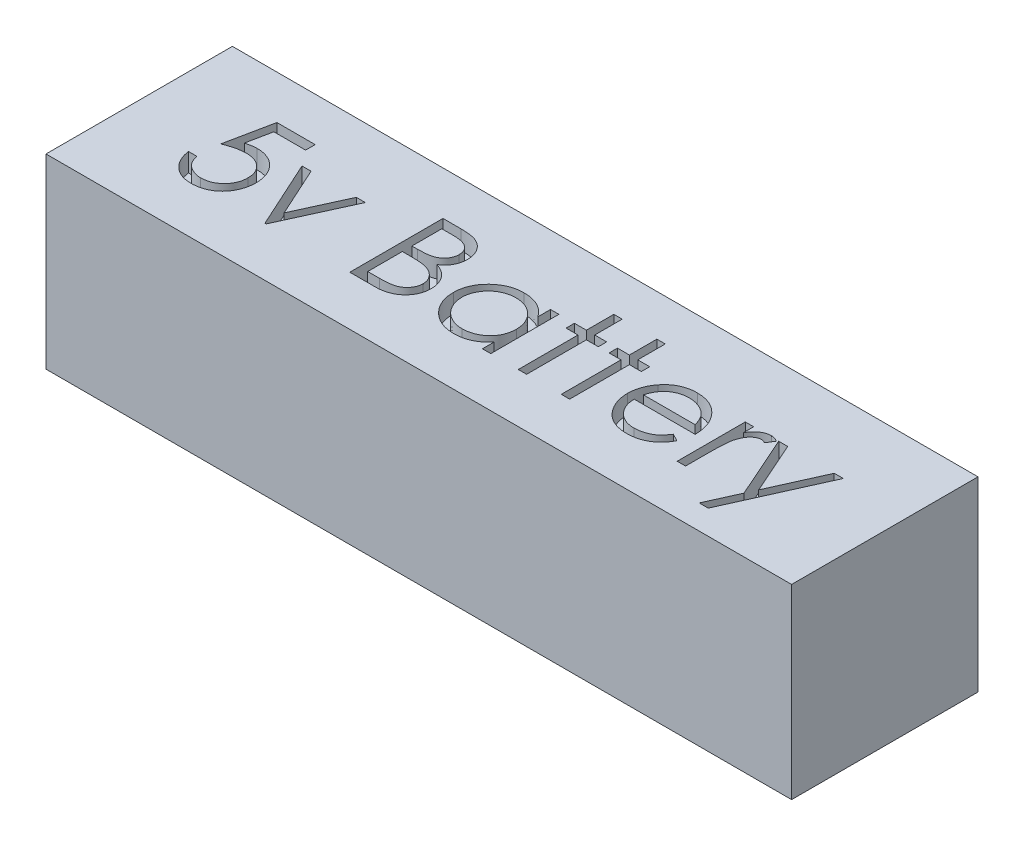
from build123d import *

# Parameters (mm, degrees)
SKETCH1_W           = 101.6
SKETCH1_H           = 25.4
BOSS_EXTRUDE1_DEPTH = 25.4
CUT_EXTRUDE1_DEPTH  = 2.54


with BuildPart() as part:
    # Sketch1 → Boss-Extrude1 (new body)
    with BuildSketch(Plane(origin=(0, 0, 0), x_dir=(1, 0, 0), z_dir=(0, 1, 0))):
        Rectangle(SKETCH1_W, SKETCH1_H)
    extrude(amount=BOSS_EXTRUDE1_DEPTH)

    # Sketch2 → Cut-Extrude1 (cut)
    # profile 1 of 9: a face of its own
    with BuildSketch(Plane(origin=(0, 25.4, 0), x_dir=(1, 0, 0), z_dir=(0, 1, 0))):
        with BuildLine():
            Line((-33.566758385, 6.741806463), (-33.566758385, 5.439242361))
            Line((-33.566758385, 5.439242361), (-37.886590115, 5.439242361))
            Line((-37.886590115, 5.439242361), (-38.570945083, 2.098877777))
            add(Edge.make_bspline(
                [(-38.570945083, 2.098877777), (-38.436485196, 2.135999049), (-38.175990431, 2.207915643), (-37.791507507, 2.287765152), (-37.426501512, 2.335899764), (-37.189645168, 2.342472233), (-37.075031622, 2.345652617)],
                knots=[0, 0, 0, 0, 1.100273476, 2.13160584, 3.095893838, 4, 4, 4, 4], degree=3))
            add(Edge.make_bspline(
                [(-37.075031622, 2.345652617), (-36.933213481, 2.342583079), (-36.654363582, 2.3365476), (-36.246370831, 2.278592604), (-35.856905761, 2.187370628), (-35.486782875, 2.059933306), (-35.135317449, 1.896975131), (-34.805743154, 1.69341249), (-34.493113013, 1.455620117), (-34.203035601, 1.18222536), (-33.939875968, 0.88133835), (-33.70849652, 0.557822647), (-33.511963692, 0.214822273), (-33.353900382, -0.150939936), (-33.22768294, -0.535420293), (-33.143674273, -0.942664235), (-33.087733643, -1.368833128), (-33.081483842, -1.660223996), (-33.078296846, -1.80881453)],
                knots=[0, 0, 0, 0, 1.052922333, 2.070308379, 3.05430497, 4.020497103, 4.973039431, 5.925935799, 6.892292201, 7.88610001, 8.88166317, 9.857072816, 10.836096531, 11.812156883, 12.81219415, 13.836441305, 14.89672472, 16, 16, 16, 16], degree=3))
            add(Edge.make_bspline(
                [(-33.078296846, -1.80881453), (-33.080710119, -1.912309444), (-33.085504052, -2.117900628), (-33.109882927, -2.42322387), (-33.156821097, -2.722083293), (-33.219841125, -3.014518544), (-33.301637898, -3.29997598), (-33.40065818, -3.579272667), (-33.521838051, -3.85067024), (-33.654757613, -4.116736673), (-33.804423404, -4.371456971), (-33.970533988, -4.609669008), (-34.146031628, -4.834946258), (-34.334867512, -5.04487266), (-34.538796837, -5.238068754), (-34.75534986, -5.415681089), (-34.982798583, -5.580713345), (-35.224661891, -5.726466511), (-35.475550329, -5.860589237), (-35.739087003, -5.970620358), (-36.009272973, -6.068992846), (-36.28999695, -6.14740456), (-36.58062307, -6.208845544), (-36.881630398, -6.250576295), (-37.191440258, -6.280970796), (-37.401443875, -6.282873463), (-37.507523609, -6.283834563)],
                knots=[0, 0, 0, 0, 1.056347294, 2.098418968, 3.122841568, 4.141288669, 5.149314143, 6.15115421, 7.162517403, 8.180376062, 9.185164535, 10.17417709, 11.141909838, 12.097768115, 13.052685741, 14.0056014, 14.954263652, 15.917497458, 16.885230207, 17.854509472, 18.828990115, 19.81800267, 20.826176721, 21.857883937, 22.917946725, 24, 24, 24, 24], degree=3))
            add(Edge.make_bspline(
                [(-37.507523609, -6.283834563), (-37.634067065, -6.281327808), (-37.883026365, -6.276396063), (-38.247772422, -6.224803274), (-38.598708277, -6.150911349), (-38.93300893, -6.039745455), (-39.253670373, -5.900454415), (-39.556375663, -5.724410021), (-39.848859479, -5.524914416), (-40.119231726, -5.289491421), (-40.370169624, -5.032168803), (-40.594801813, -4.752922505), (-40.794857935, -4.456361387), (-40.967134331, -4.141045228), (-41.114084294, -3.807802558), (-41.229527251, -3.455384812), (-41.322702996, -3.085633369), (-41.362121693, -2.831076346), (-41.382143, -2.70178328)],
                knots=[0, 0, 0, 0, 1.0467383, 2.05933395, 3.04377827, 4.011590433, 4.970194871, 5.932262533, 6.905835911, 7.896367577, 8.894135286, 9.877477877, 10.858688626, 11.851381753, 12.8477658, 13.868841284, 14.917554742, 16, 16, 16, 16], degree=3))
            Line((-41.382143, -2.70178328), (-40.24239941, -2.70178328))
            add(Edge.make_bspline(
                [(-40.24239941, -2.70178328), (-40.214355788, -2.822892122), (-40.160454388, -3.055670041), (-40.0421421, -3.382718051), (-39.897485923, -3.674162091), (-39.725475859, -3.933857436), (-39.520280034, -4.16031294), (-39.286130392, -4.362123422), (-39.02361151, -4.544187463), (-38.731898935, -4.695944361), (-38.424148618, -4.825370981), (-38.102050456, -4.911555702), (-37.774374685, -4.972156085), (-37.552747456, -4.978222188), (-37.441377776, -4.98127046)],
                knots=[0, 0, 0, 0, 1.136247022, 2.183929868, 3.172523383, 4.106158343, 5.02341133, 5.958108904, 6.928429099, 7.938127109, 8.96079061, 9.975095812, 10.982467395, 12, 12, 12, 12], degree=3))
            add(Edge.make_bspline(
                [(-37.441377776, -4.98127046), (-37.33267142, -4.978292209), (-37.118627717, -4.972428008), (-36.803626399, -4.927292164), (-36.499505399, -4.857777548), (-36.209265561, -4.753746931), (-35.927827975, -4.627310381), (-35.662311722, -4.465058535), (-35.405035568, -4.278332182), (-35.163996341, -4.064403839), (-34.943236053, -3.828656661), (-34.748178128, -3.576552977), (-34.585701899, -3.307614705), (-34.44878099, -3.026497836), (-34.344810449, -2.730121357), (-34.270638888, -2.419874236), (-34.227084932, -2.094990165), (-34.221093507, -1.873395812), (-34.218040436, -1.760477191)],
                knots=[0, 0, 0, 0, 1.027316725, 2.022795036, 3.002884548, 3.971462791, 4.93288096, 5.914575861, 6.907176829, 7.935150275, 8.956128384, 9.956726525, 10.942570165, 11.921478529, 12.907843606, 13.90538589, 14.932640048, 16, 16, 16, 16], degree=3))
            add(Edge.make_bspline(
                [(-34.218040436, -1.760477191), (-34.220429776, -1.658602321), (-34.225106568, -1.459196757), (-34.263317495, -1.167462494), (-34.329781937, -0.891426026), (-34.422034302, -0.629754377), (-34.539162801, -0.382200744), (-34.682296563, -0.148509639), (-34.85412175, 0.068238841), (-35.050398031, 0.268146107), (-35.265420066, 0.452640367), (-35.50288736, 0.609917481), (-35.757830523, 0.742229411), (-36.027177927, 0.85641329), (-36.317336273, 0.938421709), (-36.622559482, 0.999990894), (-36.946143537, 1.035606638), (-37.167380034, 1.040548348), (-37.281101333, 1.043088514)],
                knots=[0, 0, 0, 0, 1.045622112, 2.046656509, 3.013763289, 3.955457236, 4.890082067, 5.820317437, 6.762574623, 7.722996705, 8.69280354, 9.665887285, 10.63943826, 11.638615906, 12.663482002, 13.728887084, 14.832589034, 16, 16, 16, 16], degree=3))
            add(Edge.make_bspline(
                [(-37.281101333, 1.043088514), (-37.379540589, 1.040981798), (-37.582792679, 1.036631963), (-37.894569793, 1.004604389), (-38.222199759, 0.952936092), (-38.564426643, 0.881865994), (-38.922278201, 0.788861801), (-39.294999255, 0.677412042), (-39.683373479, 0.544163646), (-39.945057794, 0.443535328), (-40.079578897, 0.391806463)],
                knots=[0, 0, 0, 0, 0.817624296, 1.688186739, 2.600797293, 3.572016777, 4.590301741, 5.671205678, 6.80286297, 8, 8, 8, 8], degree=3))
            Line((-40.079578897, 0.391806463), (-38.777014795, 6.741806463))
            Line((-38.777014795, 6.741806463), (-33.566758385, 6.741806463))
        make_face()
    # profile 2 of 9: a face of its own
    with BuildSketch(Plane(origin=(0, 25.4, 0), x_dir=(1, 0, 0), z_dir=(0, 1, 0))):
        Polygon((-31.938553256, 3.322575694), (-30.704679058, 3.322575694), (-27.623809667, -3.434475588), (-24.542940276, 3.322575694), (-23.309066077, 3.322575694), (-27.54239941, -5.958193537), (-27.705219923, -5.958193537), align=None)
    # profile 3 of 9: a face of its own
    with BuildSketch(Plane(origin=(0, 25.4, 0), x_dir=(1, 0, 0), z_dir=(0, 1, 0))):
        with BuildLine():
            Line((-16.144963513, 6.741806463), (-13.667038833, 6.741806463))
            add(Edge.make_bspline(
                [(-13.667038833, 6.741806463), (-13.545741212, 6.74116874), (-13.310636235, 6.739932675), (-12.96875426, 6.720762456), (-12.648537147, 6.694623425), (-12.349892031, 6.653148518), (-12.07295691, 6.603104069), (-11.816897198, 6.542500336), (-11.582527145, 6.469832338), (-11.302718072, 6.354275832), (-10.983691674, 6.182560335), (-10.638257507, 5.928819542), (-10.34287641, 5.61845889), (-10.088200344, 5.268364683), (-9.885721996, 4.883243454), (-9.739239117, 4.472274398), (-9.646500541, 4.040758363), (-9.636963079, 3.74451026), (-9.632143, 3.594791239)],
                knots=[0, 0, 0, 0, 1.001505555, 1.941167018, 2.826882275, 3.653841531, 4.429895133, 5.150066043, 5.825578002, 6.45369114, 7.647487171, 8.808567382, 9.977351308, 11.170798116, 12.373658725, 13.556498008, 14.765093433, 16, 16, 16, 16], degree=3))
            add(Edge.make_bspline(
                [(-9.632143, 3.594791239), (-9.636109821, 3.45453768), (-9.643904999, 3.178926209), (-9.718445869, 2.775813298), (-9.835143151, 2.392087447), (-9.997359341, 2.029149077), (-10.208186584, 1.695198538), (-10.458043912, 1.387541887), (-10.759494024, 1.119205195), (-10.985348066, 0.96918952), (-11.100071686, 0.892988354)],
                knots=[0, 0, 0, 0, 1.044552857, 2.05264487, 3.044412934, 4.028983338, 5.005914585, 5.980388656, 6.974128949, 8, 8, 8, 8], degree=3))
            add(Edge.make_bspline(
                [(-11.100071686, 0.892988354), (-10.955798134, 0.837598215), (-10.679767091, 0.731623158), (-10.299906417, 0.544260189), (-9.97262798, 0.34047196), (-9.695415479, 0.11792496), (-9.458333131, -0.121955582), (-9.251312457, -0.382686996), (-9.074668614, -0.667670489), (-8.923310291, -0.973934746), (-8.805204805, -1.298352502), (-8.716755095, -1.637880747), (-8.666073208, -1.99130199), (-8.658860909, -2.231823224), (-8.655219923, -2.35324562)],
                knots=[0, 0, 0, 0, 1.27268992, 2.434971085, 3.483601985, 4.442670788, 5.356604649, 6.2567628, 7.179492994, 8.113709626, 9.066344395, 10.018646069, 10.999752585, 12, 12, 12, 12], degree=3))
            add(Edge.make_bspline(
                [(-8.655219923, -2.35324562), (-8.658764479, -2.477222556), (-8.665738491, -2.721150651), (-8.717191532, -3.079490711), (-8.804310291, -3.421936946), (-8.924311308, -3.750704323), (-9.08092885, -4.065156811), (-9.27153032, -4.365650654), (-9.498793422, -4.649166654), (-9.753021547, -4.918855229), (-10.040629903, -5.161344629), (-10.350929928, -5.377301622), (-10.687829432, -5.554905904), (-11.045795239, -5.704098325), (-11.4288429, -5.818061588), (-11.835252361, -5.897790642), (-12.264673114, -5.951511776), (-12.559348496, -5.955928491), (-12.71046832, -5.958193537)],
                knots=[0, 0, 0, 0, 0.978564426, 1.925352924, 2.850884081, 3.763762016, 4.682927383, 5.618979971, 6.567305752, 7.547517671, 8.540179244, 9.531824382, 10.526200242, 11.540722885, 12.589160233, 13.674978461, 14.80764778, 16, 16, 16, 16], degree=3))
            Line((-12.71046832, -5.958193537), (-16.144963513, -5.958193537))
            Line((-16.144963513, -5.958193537), (-16.144963513, 6.741806463))
        make_face()
        with BuildLine():
            Line((-15.005219923, 5.439242361), (-15.005219923, 1.36872954))
            Line((-15.005219923, 1.36872954), (-14.239454699, 1.36872954))
            add(Edge.make_bspline(
                [(-14.239454699, 1.36872954), (-14.127517641, 1.370180689), (-13.911232435, 1.372984605), (-13.598014524, 1.38101651), (-13.307275173, 1.403506553), (-13.039516236, 1.425990133), (-12.795159367, 1.462546494), (-12.574745927, 1.506060768), (-12.374816733, 1.552081595), (-12.144258953, 1.630348019), (-11.882737111, 1.746018441), (-11.603942705, 1.925530532), (-11.358163344, 2.139341756), (-11.150619263, 2.386051817), (-10.980760498, 2.65770912), (-10.86278216, 2.949979229), (-10.782782015, 3.255577994), (-10.775555601, 3.465375654), (-10.77188659, 3.571894604)],
                knots=[0, 0, 0, 0, 1.156816544, 2.235205308, 3.236616184, 4.169592532, 5.011045266, 5.787822928, 6.49130361, 7.128639758, 8.301311294, 9.436451833, 10.541879658, 11.654887649, 12.756523258, 13.837046038, 14.901820046, 16, 16, 16, 16], degree=3))
            add(Edge.make_bspline(
                [(-10.77188659, 3.571894604), (-10.773795872, 3.642382404), (-10.777541138, 3.78065192), (-10.80821455, 3.982216719), (-10.86034832, 4.171786907), (-10.927311042, 4.351960393), (-11.020887141, 4.517103392), (-11.131063136, 4.672925845), (-11.264179784, 4.814121246), (-11.415699175, 4.946090569), (-11.589901893, 5.063092141), (-11.786684009, 5.165565767), (-12.008707865, 5.2480823), (-12.252231653, 5.320349482), (-12.521003885, 5.371107005), (-12.811922979, 5.413392155), (-13.127371817, 5.434919533), (-13.345612617, 5.437769278), (-13.458425051, 5.439242361)],
                knots=[0, 0, 0, 0, 0.91205012, 1.789085906, 2.630437955, 3.453916878, 4.269457761, 5.079663411, 5.91843418, 6.774407191, 7.675494373, 8.627863946, 9.638891023, 10.736472738, 11.911756761, 13.175263542, 14.539845004, 16, 16, 16, 16], degree=3))
            Line((-13.458425051, 5.439242361), (-15.005219923, 5.439242361))
        make_face(mode=Mode.SUBTRACT)
        with BuildLine():
            Line((-15.005219923, 0.066165437), (-15.005219923, -4.655629434))
            Line((-15.005219923, -4.655629434), (-13.382102936, -4.655629434))
            add(Edge.make_bspline(
                [(-13.382102936, -4.655629434), (-13.265919976, -4.654236979), (-13.041992638, -4.651553206), (-12.71868246, -4.642791823), (-12.419023769, -4.622862708), (-12.144383962, -4.591490625), (-11.891797463, -4.557460252), (-11.664294369, -4.511699319), (-11.460030495, -4.459270233), (-11.223178007, -4.378229094), (-10.956465277, -4.252330471), (-10.669043027, -4.062504564), (-10.413496464, -3.83635999), (-10.196488809, -3.574627815), (-10.018641679, -3.290034143), (-9.889263314, -2.988335302), (-9.809467919, -2.674516388), (-9.799808048, -2.46055146), (-9.794963513, -2.35324562)],
                knots=[0, 0, 0, 0, 1.160039823, 2.235823828, 3.228722157, 4.157150951, 4.99529583, 5.772374946, 6.472645482, 7.099169577, 8.269452708, 9.405989375, 10.527446681, 11.663510218, 12.788923519, 13.866172445, 14.929861265, 16, 16, 16, 16], degree=3))
            add(Edge.make_bspline(
                [(-9.794963513, -2.35324562), (-9.795965377, -2.286141213), (-9.797952946, -2.153014799), (-9.827927177, -1.957377398), (-9.871520362, -1.767872087), (-9.927877279, -1.583984285), (-10.009953631, -1.409038605), (-10.105771666, -1.239575032), (-10.218117323, -1.07536955), (-10.393174725, -0.867770802), (-10.647798783, -0.628586212), (-11.00959194, -0.394407275), (-11.420971421, -0.205548089), (-11.719339752, -0.125358561), (-11.873469122, -0.083934723)],
                knots=[0, 0, 0, 0, 0.723448775, 1.435228256, 2.130040452, 2.821711965, 3.505591119, 4.210454504, 4.921174351, 5.648778258, 7.137944449, 8.670945889, 10.280296675, 12, 12, 12, 12], degree=3))
            add(Edge.make_bspline(
                [(-11.873469122, -0.083934723), (-11.935260412, -0.071397704), (-12.069236676, -0.044214861), (-12.287704182, -0.015521194), (-12.537117192, 0.010042309), (-12.818051632, 0.028951367), (-13.130862942, 0.048496825), (-13.476219189, 0.056098033), (-13.852710017, 0.065166776), (-14.113939482, 0.065824035), (-14.249630981, 0.066165437)],
                knots=[0, 0, 0, 0, 0.634451884, 1.375622551, 2.216452059, 3.157844607, 4.20941857, 5.370758133, 6.634282058, 8, 8, 8, 8], degree=3))
            Line((-14.249630981, 0.066165437), (-15.005219923, 0.066165437))
        make_face(mode=Mode.SUBTRACT)
    # profile 4 of 9: a face of its own
    with BuildSketch(Plane(origin=(0, 25.4, 0), x_dir=(1, 0, 0), z_dir=(0, 1, 0))):
        with BuildLine():
            Line((3.067857, 3.322575694), (3.067857, -5.958193537))
            Line((3.067857, -5.958193537), (1.92811341, -5.958193537))
            Line((1.92811341, -5.958193537), (1.92811341, -4.352885043))
            add(Edge.make_bspline(
                [(1.92811341, -4.352885043), (1.799593799, -4.49817157), (1.54878616, -4.781700054), (1.129899818, -5.152112508), (0.685878144, -5.458285275), (0.218876207, -5.705572112), (-0.270684276, -5.891326145), (-0.781718078, -6.023355922), (-1.31443366, -6.108242124), (-1.67820649, -6.116718546), (-1.862551654, -6.12101405)],
                knots=[0, 0, 0, 0, 1.074387032, 2.096679803, 3.090159297, 4.057316773, 5.018401886, 5.985159533, 6.978961417, 8, 8, 8, 8], degree=3))
            add(Edge.make_bspline(
                [(-1.862551654, -6.12101405), (-2.026446801, -6.11656407), (-2.349655287, -6.107788514), (-2.825103653, -6.039708155), (-3.282638386, -5.930377042), (-3.722691836, -5.778336672), (-4.142416478, -5.57665769), (-4.545405971, -5.335208019), (-4.929572597, -5.047677007), (-5.289060752, -4.718971876), (-5.620102582, -4.361938636), (-5.910610629, -3.981136223), (-6.152828947, -3.578211292), (-6.355376097, -3.158265277), (-6.511391404, -2.718065426), (-6.620152877, -2.259133988), (-6.688153926, -1.782013589), (-6.696925855, -1.457113034), (-6.701373769, -1.292368216)],
                knots=[0, 0, 0, 0, 1.033919861, 2.038935746, 3.024066025, 3.998881131, 4.97069526, 5.957263378, 6.95902576, 7.993208707, 9.027059324, 10.027763471, 11.009749337, 11.988697705, 12.965288445, 13.950418724, 14.960734635, 16, 16, 16, 16], degree=3))
            add(Edge.make_bspline(
                [(-6.701373769, -1.292368216), (-6.696827273, -1.131028492), (-6.687839095, -0.812068561), (-6.620880269, -0.342971571), (-6.508282038, 0.108851833), (-6.350265562, 0.541947027), (-6.14763904, 0.956838066), (-5.901157124, 1.353818385), (-5.610802014, 1.733981627), (-5.276057566, 2.08838865), (-4.913437114, 2.415760593), (-4.525511148, 2.700273415), (-4.121929527, 2.945988838), (-3.696432317, 3.140674309), (-3.255317394, 3.298187346), (-2.794657748, 3.407164116), (-2.31637002, 3.47138011), (-1.991647377, 3.480679283), (-1.826934667, 3.485396207)],
                knots=[0, 0, 0, 0, 1.020392517, 2.01726096, 2.990465484, 3.961182959, 4.928053699, 5.906110375, 6.912531644, 7.948652711, 8.985773172, 9.998621852, 10.987621588, 11.969261332, 12.953316658, 13.946091881, 14.958173133, 16, 16, 16, 16], degree=3))
            add(Edge.make_bspline(
                [(-1.826934667, 3.485396207), (-1.637523749, 3.480179223), (-1.26609788, 3.469948963), (-0.722799104, 3.384812781), (-0.208831998, 3.240981771), (0.279770936, 3.045338279), (0.74125514, 2.785355747), (1.171251683, 2.457405603), (1.574260722, 2.063556153), (1.807869209, 1.76104054), (1.92811341, 1.605328098)],
                knots=[0, 0, 0, 0, 1.038897134, 2.037228247, 3.008116434, 3.962042015, 4.918381754, 5.904844433, 6.921570401, 8, 8, 8, 8], degree=3))
            Line((1.92811341, 1.605328098), (1.92811341, 3.322575694))
            Line((1.92811341, 3.322575694), (3.067857, 3.322575694))
        make_face()
        with BuildLine():
            add(Edge.make_bspline(
                [(-1.811670244, 2.345652617), (-1.978273698, 2.339724846), (-2.307122418, 2.328024368), (-2.789882083, 2.236680543), (-3.251847899, 2.0846993), (-3.690709369, 1.876847831), (-4.099534041, 1.615486415), (-4.464908218, 1.299360253), (-4.789820305, 0.937094516), (-5.063081721, 0.530324001), (-5.285841525, 0.094249213), (-5.442476183, -0.361588034), (-5.545778881, -0.828966095), (-5.556332656, -1.145967841), (-5.561630179, -1.305088569)],
                knots=[0, 0, 0, 0, 1.031046209, 2.035121221, 3.029706178, 4.034933723, 5.034054252, 6.02443088, 7.017295772, 8.038157696, 9.050218397, 10.03989886, 11.016116709, 12, 12, 12, 12], degree=3))
            add(Edge.make_bspline(
                [(-5.561630179, -1.305088569), (-5.554863281, -1.463258386), (-5.541356008, -1.778978049), (-5.444289202, -2.246993285), (-5.281439376, -2.702937952), (-5.059218177, -3.142942128), (-4.780955281, -3.551461578), (-4.458416456, -3.92063288), (-4.088482578, -4.2380951), (-3.678717053, -4.503842867), (-3.241082417, -4.7185183), (-2.780856437, -4.867890764), (-2.30669055, -4.964330139), (-1.98428351, -4.975594955), (-1.821846526, -4.98127046)],
                knots=[0, 0, 0, 0, 0.979072187, 1.954306742, 2.945804271, 3.96968567, 4.997920485, 5.998718438, 6.996577872, 8.005894225, 9.015743152, 10.005417472, 10.995077863, 12, 12, 12, 12], degree=3))
            add(Edge.make_bspline(
                [(-1.821846526, -4.98127046), (-1.656940644, -4.975247162), (-1.328959202, -4.963267421), (-0.844767319, -4.871532544), (-0.374885597, -4.719971475), (0.074285204, -4.509880358), (0.492718022, -4.249503667), (0.868267464, -3.944677937), (1.185825406, -3.590154954), (1.45503859, -3.200531825), (1.666132244, -2.773405438), (1.819896802, -2.318621374), (1.910806689, -1.836163802), (1.922264736, -1.506457553), (1.92811341, -1.338161486)],
                knots=[0, 0, 0, 0, 1.01762866, 2.023962475, 3.030623092, 4.058876274, 5.077231937, 6.066672613, 7.034107872, 8.005628644, 8.981990164, 9.965428785, 10.961468474, 12, 12, 12, 12], degree=3))
            add(Edge.make_bspline(
                [(1.92811341, -1.338161486), (1.924631229, -1.209935643), (1.917777193, -0.957546608), (1.865414841, -0.586969616), (1.782121251, -0.23233581), (1.664750862, 0.106727662), (1.510568202, 0.428346146), (1.324612023, 0.734828933), (1.103612248, 1.024582015), (0.851126465, 1.293615444), (0.574755587, 1.539002892), (0.28231254, 1.758038851), (-0.029667485, 1.937975255), (-0.355937876, 2.086896441), (-0.697064718, 2.205402499), (-1.055823825, 2.284460702), (-1.428401863, 2.338745295), (-1.682568978, 2.343325934), (-1.811670244, 2.345652617)],
                knots=[0, 0, 0, 0, 1.050140795, 2.067009409, 3.05949893, 4.030605086, 5.00011959, 5.97591094, 6.962425594, 7.979863591, 8.993523472, 9.986985069, 10.967611495, 11.937549037, 12.921786183, 13.919465291, 14.943216303, 16, 16, 16, 16], degree=3))
        make_face(mode=Mode.SUBTRACT)
    # profile 5 of 9: a face of its own
    with BuildSketch(Plane(origin=(0, 25.4, 0), x_dir=(1, 0, 0), z_dir=(0, 1, 0))):
        Polygon((6.812728795, 7.067447489), (7.952472385, 7.067447489), (7.952472385, 3.322575694), (9.580677513, 3.322575694), (9.580677513, 2.182832104), (7.952472385, 2.182832104), (7.952472385, -5.958193537), (6.812728795, -5.958193537), (6.812728795, 2.182832104), (5.184523667, 2.182832104), (5.184523667, 3.322575694), (6.812728795, 3.322575694), align=None)
    # profile 6 of 9: a face of its own
    with BuildSketch(Plane(origin=(0, 25.4, 0), x_dir=(1, 0, 0), z_dir=(0, 1, 0))):
        Polygon((12.674267256, 7.067447489), (13.814010846, 7.067447489), (13.814010846, 3.322575694), (15.442215974, 3.322575694), (15.442215974, 2.182832104), (13.814010846, 2.182832104), (13.814010846, -5.958193537), (12.674267256, -5.958193537), (12.674267256, 2.182832104), (11.046062128, 2.182832104), (11.046062128, 3.322575694), (12.674267256, 3.322575694), align=None)
    # profile 7 of 9: a face of its own
    with BuildSketch(Plane(origin=(0, 25.4, 0), x_dir=(1, 0, 0), z_dir=(0, 1, 0))):
        with BuildLine():
            Line((25.013009244, -3.027424306), (26.025549308, -3.559135043))
            add(Edge.make_bspline(
                [(26.025549308, -3.559135043), (25.944862234, -3.702257988), (25.78787714, -3.980718561), (25.517908712, -4.363285598), (25.234908906, -4.70744731), (24.926103079, -5.004009198), (24.600730244, -5.262549938), (24.256986039, -5.488747187), (23.893080901, -5.681491533), (23.508997614, -5.843879277), (23.101510671, -5.968736584), (22.669632597, -6.056926186), (22.212536028, -6.111439189), (21.899222747, -6.117771557), (21.738790494, -6.12101405)],
                knots=[0, 0, 0, 0, 1.120438281, 2.179929193, 3.190490725, 4.156257408, 5.095198341, 6.022838206, 6.959905092, 7.901321166, 8.864066838, 9.862729781, 10.905609505, 12, 12, 12, 12], degree=3))
            add(Edge.make_bspline(
                [(21.738790494, -6.12101405), (21.560475318, -6.116851442), (21.212634069, -6.108731401), (20.706304129, -6.038727315), (20.229584525, -5.924527614), (19.782502059, -5.764995506), (19.366151599, -5.556616359), (18.97970564, -5.302763382), (18.621131932, -5.004740629), (18.301729802, -4.659966677), (18.014187713, -4.291006432), (17.760456881, -3.906537937), (17.548339917, -3.507528522), (17.375791874, -3.096518335), (17.236437078, -2.676097921), (17.139312182, -2.242442025), (17.083324239, -1.796724333), (17.074744679, -1.495199715), (17.070421103, -1.343249627)],
                knots=[0, 0, 0, 0, 1.145258523, 2.234067595, 3.276747158, 4.290159414, 5.277019952, 6.260822364, 7.254936242, 8.264827045, 9.274100331, 10.257902744, 11.220704747, 12.172965371, 13.118907548, 14.062713208, 15.023725156, 16, 16, 16, 16], degree=3))
            add(Edge.make_bspline(
                [(17.070421103, -1.343249627), (17.074264273, -1.200665528), (17.081880928, -0.918082673), (17.129889785, -0.499833411), (17.214973591, -0.093330169), (17.331727681, 0.301764828), (17.482499346, 0.684790057), (17.666947684, 1.05597863), (17.885360026, 1.414935566), (18.053989443, 1.641369794), (18.138930718, 1.755428258)],
                knots=[0, 0, 0, 0, 1.024358464, 2.0301432, 3.019427413, 4.004406732, 4.986367066, 5.972626655, 6.978780325, 8, 8, 8, 8], degree=3))
            add(Edge.make_bspline(
                [(18.138930718, 1.755428258), (18.25398431, 1.892838158), (18.480446887, 2.163305161), (18.863465663, 2.518681372), (19.278212089, 2.81638307), (19.719488561, 3.063151821), (20.192423767, 3.25065334), (20.690660337, 3.390380853), (21.219871465, 3.468678207), (21.58165898, 3.479737489), (21.766775269, 3.485396207)],
                knots=[0, 0, 0, 0, 1.030682036, 2.02871468, 2.997146059, 3.962720338, 4.930598197, 5.918074684, 6.934738563, 8, 8, 8, 8], degree=3))
            add(Edge.make_bspline(
                [(21.766775269, 3.485396207), (21.957085151, 3.480482944), (22.330429758, 3.470844241), (22.874832026, 3.381485832), (23.389946626, 3.239780848), (23.875567427, 3.039651379), (24.331743665, 2.781443863), (24.755510188, 2.461614895), (25.154114247, 2.08998355), (25.386011091, 1.804185619), (25.504014853, 1.658753579)],
                knots=[0, 0, 0, 0, 1.056321875, 2.072262726, 3.055038591, 4.01806755, 4.982017516, 5.957941055, 6.960871419, 8, 8, 8, 8], degree=3))
            add(Edge.make_bspline(
                [(25.504014853, 1.658753579), (25.584304029, 1.549157726), (25.744347952, 1.330695524), (25.944816001, 0.974474468), (26.118832834, 0.60178174), (26.257926721, 0.206592948), (26.370555769, -0.206409529), (26.452041939, -0.640178191), (26.499828841, -1.094583869), (26.509222114, -1.404197371), (26.514010846, -1.562039691)],
                knots=[0, 0, 0, 0, 0.94817472, 1.890038105, 2.849395472, 3.817997239, 4.812318967, 5.836947057, 6.897266129, 8, 8, 8, 8], degree=3))
            Line((26.514010846, -1.562039691), (18.210164692, -1.562039691))
            add(Edge.make_bspline(
                [(18.210164692, -1.562039691), (18.215751264, -1.684324232), (18.226737033, -1.924791852), (18.277954838, -2.276657265), (18.358686103, -2.611840535), (18.47214813, -2.927827573), (18.609550683, -3.228745464), (18.777864569, -3.512361998), (18.978668094, -3.777385344), (19.202644203, -4.026186101), (19.451952806, -4.247749434), (19.714235917, -4.446057308), (19.99324971, -4.612266188), (20.286794185, -4.747176073), (20.594394662, -4.85279042), (20.916148056, -4.924882227), (21.251421221, -4.973168014), (21.479969456, -4.978537085), (21.596322545, -4.98127046)],
                knots=[0, 0, 0, 0, 1.094153842, 2.151609401, 3.174256925, 4.172055639, 5.149267565, 6.128595816, 7.11444997, 8.118368179, 9.117203808, 10.09244225, 11.054858984, 12.015122123, 12.976791628, 13.957293641, 14.960065497, 16, 16, 16, 16], degree=3))
            add(Edge.make_bspline(
                [(21.596322545, -4.98127046), (21.710082423, -4.979064083), (21.935803845, -4.974686208), (22.271957813, -4.932116131), (22.602664098, -4.863281131), (22.926553951, -4.769337453), (23.237053878, -4.654758589), (23.524602017, -4.516499649), (23.789053085, -4.363556282), (24.036220364, -4.188624032), (24.275963683, -3.974508611), (24.513789276, -3.707316138), (24.768793133, -3.391312823), (24.928412512, -3.153475692), (25.013009244, -3.027424306)],
                knots=[0, 0, 0, 0, 0.99110716, 1.966546729, 2.947904876, 3.932708344, 4.903319531, 5.828989031, 6.710028674, 7.56322171, 8.463672341, 9.504779593, 10.677557249, 12, 12, 12, 12], degree=3))
        make_face()
        with BuildLine():
            add(Edge.make_bspline(
                [(25.374267256, -0.422296101), (25.332550933, -0.271119388), (25.252260439, 0.019847121), (25.084488488, 0.422766924), (24.895543183, 0.780863022), (24.671944329, 1.091394833), (24.418602096, 1.367179009), (24.125975291, 1.608183589), (23.797822192, 1.823784054), (23.435839024, 2.005765981), (23.052510261, 2.160669183), (22.651167793, 2.26453746), (22.241655248, 2.335692085), (21.964670838, 2.34231825), (21.825288891, 2.345652617)],
                knots=[0, 0, 0, 0, 1.154881502, 2.222775134, 3.210006277, 4.132804581, 5.035138423, 5.962687519, 6.919655026, 7.923214229, 8.944639381, 9.960483929, 10.97369054, 12, 12, 12, 12], degree=3))
            add(Edge.make_bspline(
                [(21.825288891, 2.345652617), (21.711535214, 2.343433123), (21.48666811, 2.33904565), (21.155375663, 2.297425467), (20.837223613, 2.228628315), (20.529864426, 2.134412616), (20.237325847, 2.008832829), (19.953590545, 1.861573693), (19.685873107, 1.681808517), (19.518446121, 1.544797816), (19.433862609, 1.475580502)],
                knots=[0, 0, 0, 0, 1.04873581, 2.073130211, 3.073294108, 4.04793562, 5.032784715, 6.005352987, 6.992311501, 8, 8, 8, 8], degree=3))
            add(Edge.make_bspline(
                [(19.433862609, 1.475580502), (19.373289843, 1.420809699), (19.250705327, 1.309966944), (19.086909721, 1.118998109), (18.930081149, 0.913071012), (18.78735618, 0.684307274), (18.656446081, 0.435311876), (18.533945592, 0.168185028), (18.423686325, -0.119100331), (18.361651869, -0.319297467), (18.329736006, -0.422296101)],
                knots=[0, 0, 0, 0, 0.879870761, 1.780643979, 2.707998968, 3.669668524, 4.684282772, 5.740141944, 6.837334558, 8, 8, 8, 8], degree=3))
            Line((18.329736006, -0.422296101), (25.374267256, -0.422296101))
        make_face(mode=Mode.SUBTRACT)
    # profile 8 of 9: a face of its own
    with BuildSketch(Plane(origin=(0, 25.4, 0), x_dir=(1, 0, 0), z_dir=(0, 1, 0))):
        with BuildLine():
            Line((28.467857, 3.322575694), (29.60760059, 3.322575694))
            Line((29.60760059, 3.322575694), (29.60760059, 1.956409829))
            add(Edge.make_bspline(
                [(29.60760059, 1.956409829), (29.691742657, 2.083612406), (29.852663708, 2.326886346), (30.120136337, 2.648629238), (30.394105568, 2.915020979), (30.675882961, 3.127305175), (30.967540638, 3.286284206), (31.262677577, 3.402736076), (31.565937139, 3.47159662), (31.769724693, 3.480790183), (31.871823346, 3.485396207)],
                knots=[0, 0, 0, 0, 1.2804753, 2.448899062, 3.506932113, 4.484331642, 5.4025378, 6.288909075, 7.142734305, 8, 8, 8, 8], degree=3))
            add(Edge.make_bspline(
                [(31.871823346, 3.485396207), (31.951021731, 3.481076296), (32.113977554, 3.472187799), (32.360657237, 3.409737092), (32.614814906, 3.310031125), (32.778617282, 3.216268031), (32.864010846, 3.167387393)],
                knots=[0, 0, 0, 0, 0.901110191, 1.854092781, 2.881294221, 4, 4, 4, 4], degree=3))
            Line((32.864010846, 3.167387393), (32.2381695, 2.180288034))
            add(Edge.make_bspline(
                [(32.2381695, 2.180288034), (32.183345338, 2.204745571), (32.079278582, 2.251170658), (31.927043442, 2.306114523), (31.786685448, 2.338466561), (31.697264537, 2.343367736), (31.655577353, 2.345652617)],
                knots=[0, 0, 0, 0, 1.180555205, 2.24091978, 3.179933427, 4, 4, 4, 4], degree=3))
            add(Edge.make_bspline(
                [(31.655577353, 2.345652617), (31.564116548, 2.339556481), (31.377563019, 2.327122132), (31.103662121, 2.229372744), (30.837879404, 2.071438301), (30.626799372, 1.896283124), (30.46336034, 1.727381116), (30.346737236, 1.579885484), (30.239756983, 1.414500163), (30.137539326, 1.234052454), (30.044407344, 1.035461298), (29.957486116, 0.820710781), (29.878895385, 0.589552171), (29.834081641, 0.428507026), (29.811126231, 0.346013194)],
                knots=[0, 0, 0, 0, 1.125678352, 2.296057538, 3.5422874, 4.923748041, 5.663163013, 6.437101912, 7.23742474, 8.08941207, 8.991984279, 9.93940061, 10.944477711, 12, 12, 12, 12], degree=3))
            add(Edge.make_bspline(
                [(29.811126231, 0.346013194), (29.793954403, 0.272436021), (29.755920111, 0.109468175), (29.718939388, -0.163939329), (29.682401422, -0.486968034), (29.656650836, -0.8605171), (29.63278194, -1.283653682), (29.619319642, -1.757022399), (29.608059675, -2.28110913), (29.607758261, -2.647501783), (29.60760059, -2.839163088)],
                knots=[0, 0, 0, 0, 0.566838948, 1.255505196, 2.06880316, 3.007127437, 4.065329342, 5.249902469, 6.561414163, 8, 8, 8, 8], degree=3))
            Line((29.60760059, -2.839163088), (29.60760059, -5.958193537))
            Line((29.60760059, -5.958193537), (28.467857, -5.958193537))
            Line((28.467857, -5.958193537), (28.467857, 3.322575694))
        make_face()
    # profile 9 of 9: a face of its own
    with BuildSketch(Plane(origin=(0, 25.4, 0), x_dir=(1, 0, 0), z_dir=(0, 1, 0))):
        Polygon((33.026831359, 3.322575694), (34.255617417, 3.322575694), (37.3975445, -3.785557319), (40.587808923, 3.322575694), (41.819139051, 3.322575694), (36.120421103, -9.377424306), (34.889090974, -9.377424306), (36.779335365, -5.166987607), align=None)
    extrude(amount=-CUT_EXTRUDE1_DEPTH, mode=Mode.SUBTRACT)


solid = part.part
